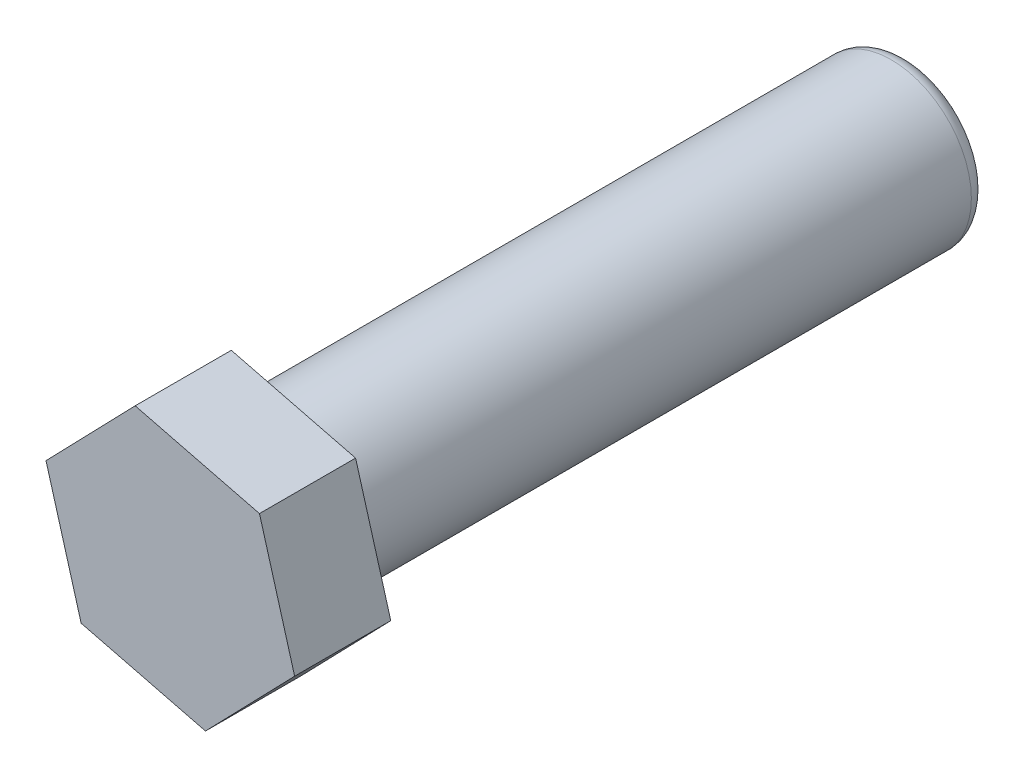
from build123d import *

# Parameters (mm, degrees)
SKETCH1_R           = 2.5
BOSS_EXTRUDE1_DEPTH = 20
BOSS_EXTRUDE2_DEPTH = 3
FILLET1_R           = 0.5


with BuildPart() as part:
    # Sketch1 → Boss-Extrude1 (new body)
    with BuildSketch(Plane.XY):
        Circle(SKETCH1_R)
    extrude(amount=BOSS_EXTRUDE1_DEPTH)

    # Sketch3 → Boss-Extrude2 (add)
    with BuildSketch(Plane.XY.offset(20)):
        Polygon((2.782434511, 2.873683732), (-1.097465859, 3.846500837), (-3.87990037, 0.972817104), (-2.782434511, -2.873683732), (1.097465859, -3.846500837), (3.87990037, -0.972817104), align=None)
    extrude(amount=BOSS_EXTRUDE2_DEPTH)

    # Fillet1
    fillet1_edges = [part.edges().sort_by_distance(p)[0] for p in [
        (-2.5, 0, 0),
    ]]
    fillet(fillet1_edges, radius=FILLET1_R)


solid = part.part
